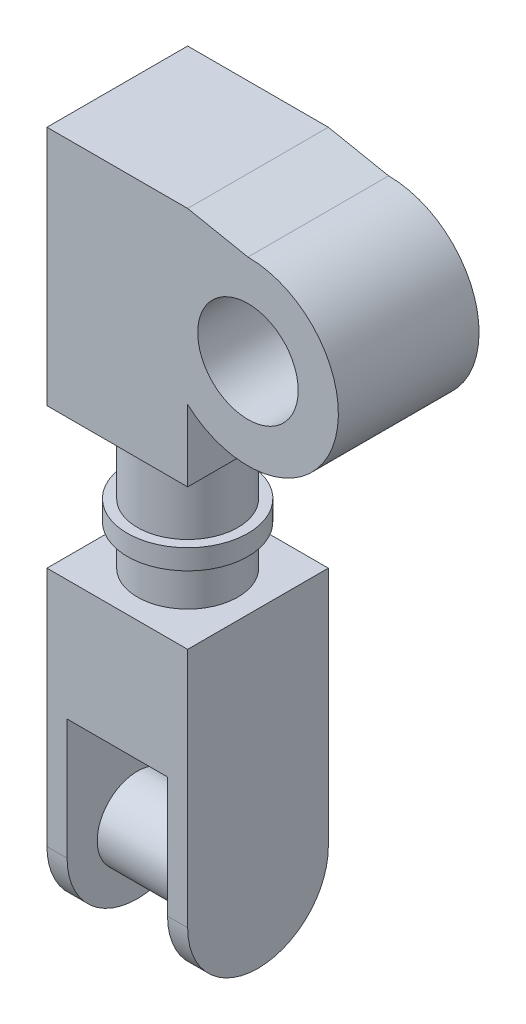
from build123d import *

# Parameters (mm, degrees)
SKETCH1_W           = 70
SKETCH1_H           = 70
BOSS_EXTRUDE1_DEPTH = 120
SKETCH2_R           = 25
BOSS_EXTRUDE2_DEPTH = 40
SKETCH3_R           = 30
BOSS_EXTRUDE3_DEPTH = 10
SKETCH4_R           = 25
BOSS_EXTRUDE4_DEPTH = 70
SKETCH5_R           = 25
BOSS_EXTRUDE5_DEPTH = 20
BOSS_EXTRUDE6_DEPTH = 35
CUT_EXTRUDE1_DEPTH  = 25
SKETCH9_R           = 20
BOSS_EXTRUDE7_DEPTH = 50


with BuildPart() as part:
    # Sketch1 → Boss-Extrude1 (new body)
    with BuildSketch(Plane(origin=(0, 0, 0), x_dir=(1, 0, 0), z_dir=(0, 1, 0))):
        Rectangle(SKETCH1_W, SKETCH1_H)
    extrude(amount=BOSS_EXTRUDE1_DEPTH)

    # Sketch2 → Boss-Extrude2 (add)
    with BuildSketch(Plane.XZ):
        with Locations(Location((0, 0, 0), (0, 0, 270))):
            Circle(SKETCH2_R)
    extrude(amount=BOSS_EXTRUDE2_DEPTH)

    # Sketch3 → Boss-Extrude3 (add)
    with BuildSketch(Plane.XZ.offset(40)):
        with Locations(Location((0, 0, 0), (0, 0, 270))):
            Circle(SKETCH3_R)
    extrude(amount=BOSS_EXTRUDE3_DEPTH)

    # Sketch4 → Boss-Extrude4 (add)
    with BuildSketch(Plane.XY.offset(35)):
        with BuildLine():
            Line((65, 114.048192782), (35, 120))
            Line((35, 120), (35, 35.50717312))
            ThreePointArc((35, 35.50717312), (107.037756153, 52.991198743), (65, 114.048192782))
        make_face()
        with Locations((65, 69.048192782)):
            Circle(SKETCH4_R, mode=Mode.SUBTRACT)
    extrude(amount=-BOSS_EXTRUDE4_DEPTH)

    # Sketch5 → Boss-Extrude5 (add)
    with BuildSketch(Plane.XZ.offset(50)):
        with Locations(Location((0, 0, 0), (0, 0, 270))):
            Circle(SKETCH5_R)
    extrude(amount=BOSS_EXTRUDE5_DEPTH)

    # Sketch6 → Boss-Extrude6 (add, symmetric)
    with BuildSketch(Plane(origin=(0, 0, 0), x_dir=(0, 0, -1), z_dir=(1, 0, 0))):
        with BuildLine():
            ThreePointArc((-35, -190), (0, -225), (35, -190))
            Line((35, -190), (35, -155))
            Line((35, -155), (35, -70))
            Line((35, -70), (-35, -70))
            Line((-35, -70), (-35, -155))
            Line((-35, -155), (-35, -190))
        make_face()
    extrude(amount=BOSS_EXTRUDE6_DEPTH, both=True)

    # Sketch8 → Cut-Extrude1 (cut, symmetric)
    with BuildSketch(Plane(origin=(0, 0, 0), x_dir=(0, 0, -1), z_dir=(1, 0, 0))):
        with BuildLine():
            Line((-35, -130), (-35, -190))
            ThreePointArc((-35, -190), (0, -225), (35, -190))
            Line((35, -190), (35, -130))
            Line((35, -130), (-35, -130))
        make_face()
    extrude(amount=CUT_EXTRUDE1_DEPTH, both=True, mode=Mode.SUBTRACT)

    # Sketch9 → Boss-Extrude7 (add)
    with BuildSketch(Plane(origin=(-25, 0, 0), x_dir=(0, 0, -1), z_dir=(1, 0, 0))):
        with Locations((0, -190)):
            Circle(SKETCH9_R)
    extrude(amount=BOSS_EXTRUDE7_DEPTH)


solid = part.part
